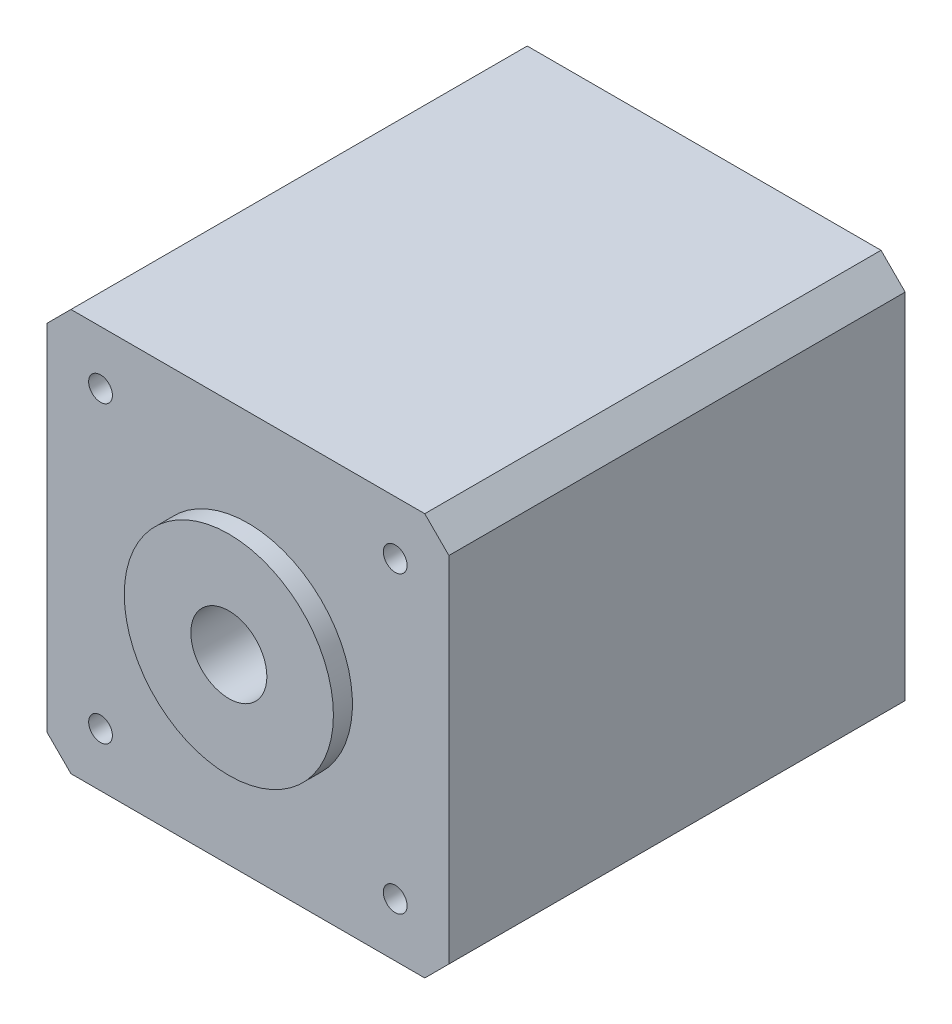
from build123d import *

# Parameters (mm, degrees)
SKETCH1_W                       = 42.3
SKETCH1_H                       = 42.3
BOSS_EXTRUDE1_DEPTH             = 48
TAP_DRILL_FOR_M3X0_5_TAP1_D     = 2.5
TAP_DRILL_FOR_M3X0_5_TAP1_DEPTH = 7.868
TAP_DRILL_FOR_M3X0_5_TAP1_TIP   = 0.751075774
SKETCH5_R                       = 11
BOSS_EXTRUDE2_DEPTH             = 2
SKETCH6_R                       = 4
CUT_EXTRUDE1_DEPTH              = 78.965248669
CHAMFER1_SIZE                   = 2.54


with BuildPart() as part:
    # Sketch1 → Boss-Extrude1 (new body)
    with BuildSketch(Plane.XY):
        with Locations((21.15, 21.15)):
            Rectangle(SKETCH1_W, SKETCH1_H)
    extrude(amount=BOSS_EXTRUDE1_DEPTH)

    # Tap Drill for M3x0.5 Tap1
    with Locations(Plane.XY.offset(48)):
        with Locations((36.65, 5.65), (36.65, 36.65), (5.65, 5.65), (5.65, 36.65)):
            Hole(TAP_DRILL_FOR_M3X0_5_TAP1_D / 2, depth=TAP_DRILL_FOR_M3X0_5_TAP1_DEPTH)
            with Locations((0, 0, -(TAP_DRILL_FOR_M3X0_5_TAP1_DEPTH + TAP_DRILL_FOR_M3X0_5_TAP1_TIP / 2))):  # 118° drill point
                Cone(0, TAP_DRILL_FOR_M3X0_5_TAP1_D / 2, TAP_DRILL_FOR_M3X0_5_TAP1_TIP, mode=Mode.SUBTRACT)

    # Sketch5 → Boss-Extrude2 (add)
    with BuildSketch(Plane.XY.offset(48)):
        with Locations(Location((21.15, 21.15, 0), (0, 0, 180))):
            Circle(SKETCH5_R)
    extrude(amount=BOSS_EXTRUDE2_DEPTH)

    # Sketch6 → Cut-Extrude1 (cut, through all)
    with BuildSketch(Plane.XY.offset(50)):
        with Locations((21.15, 21.15)):
            Circle(SKETCH6_R)
    extrude(amount=-CUT_EXTRUDE1_DEPTH, mode=Mode.SUBTRACT)

    # Chamfer1
    chamfer1_edges = [part.edges().sort_by_distance(p)[0] for p in [
        (0, 42.3, 24),
        (42.3, 42.3, 24),
        (42.3, 0, 24),
        (0, 0, 24),
    ]]
    chamfer(chamfer1_edges, length=CHAMFER1_SIZE)


solid = part.part
